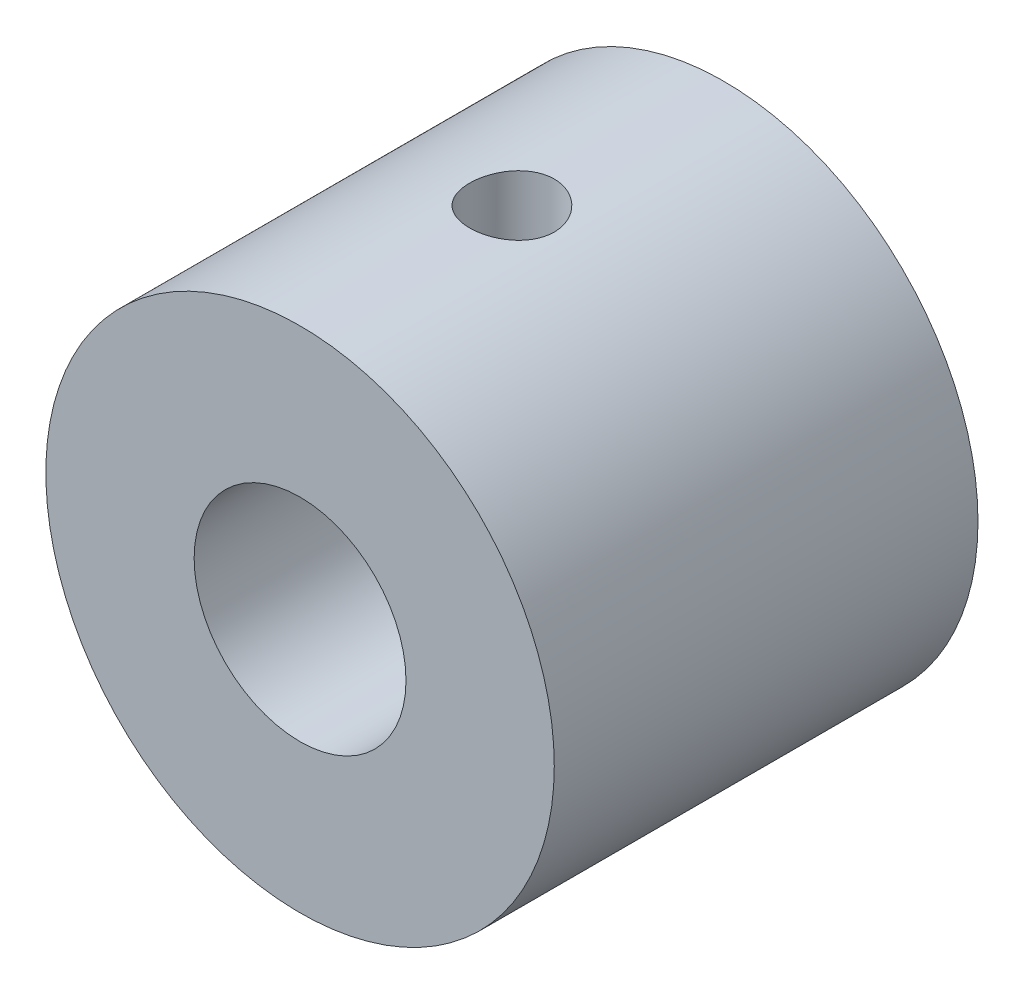
from build123d import *

# Parameters (mm, degrees)
SKIZZE1_R                            = 6
SKIZZE1_R_2                          = 2.5
AUFSATZ_LINEAR_AUSTRAGEN1_DEPTH      = 10
SCHNITT_LINEAR_AUSTRAGEN1_DEPTH      = 10
SCHNITT_LINEAR_AUSTRAGEN1_DEPTH_BACK = 10
SKIZZE2_R                            = 1


with BuildPart() as part:
    # Skizze1 → Aufsatz-Linear austragen1 (new body)
    with BuildSketch(Plane.XY):
        Circle(SKIZZE1_R)
        Circle(SKIZZE1_R_2, mode=Mode.SUBTRACT)
    extrude(amount=AUFSATZ_LINEAR_AUSTRAGEN1_DEPTH)

    # Skizze2 → Schnitt-Linear austragen1 (cut, two sides: drawn at the far end of the back side and taken through both)
    with BuildSketch(Plane(origin=(0, 0, 0), x_dir=(1, 0, 0), z_dir=(0, 1, 0)).offset(-SCHNITT_LINEAR_AUSTRAGEN1_DEPTH_BACK)):
        with Locations((0, -5)):
            Circle(SKIZZE2_R)
    extrude(amount=SCHNITT_LINEAR_AUSTRAGEN1_DEPTH + SCHNITT_LINEAR_AUSTRAGEN1_DEPTH_BACK, mode=Mode.SUBTRACT)


solid = part.part
